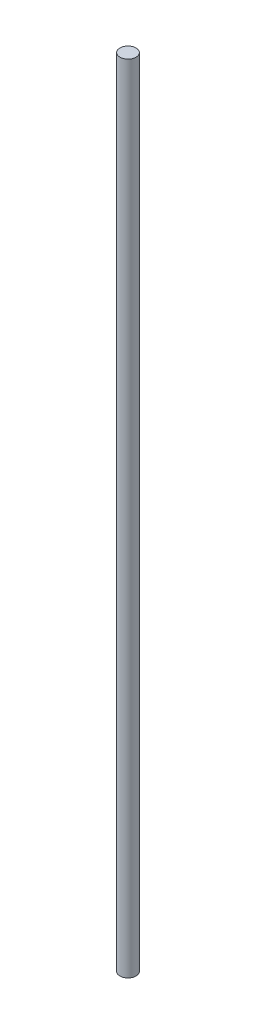
from build123d import *

# Parameters (mm, degrees)
SKETCH1_R           = 1
BOSS_EXTRUDE1_DEPTH = 49.5


with BuildPart() as part:
    # Sketch1 → Boss-Extrude1 (new, symmetric)
    with BuildSketch(Plane(origin=(0, 0, 0), x_dir=(1, 0, 0), z_dir=(0, 1, 0))):
        with Locations(Location((0, 0, 0), (0, 0, 270))):
            Circle(SKETCH1_R)
    extrude(amount=BOSS_EXTRUDE1_DEPTH, both=True)


solid = part.part
